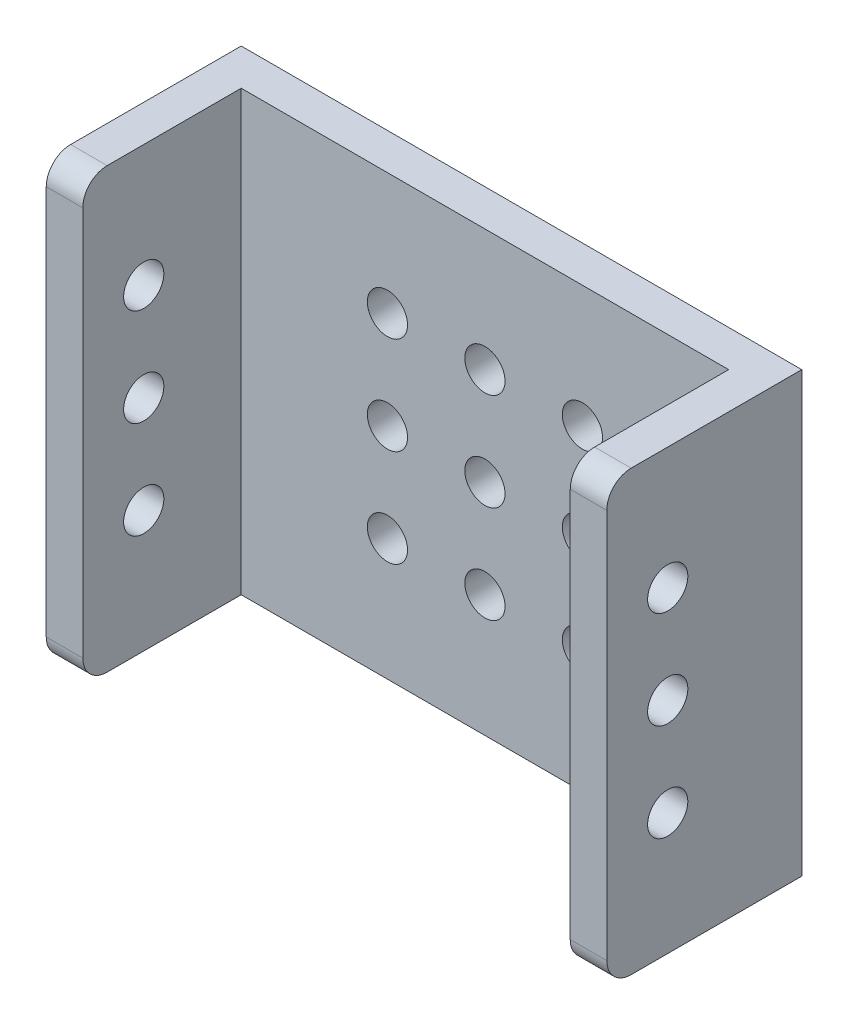
from build123d import *

# Parameters (mm, degrees)
SKETCH_2_W          = 46
SKETCH_2_H          = 36
SKETCH_2_R          = 1.65
EXTRUDE_1_DEPTH     = 3
SKETCH_3_W          = 3
SKETCH_3_H          = 36
EXTRUDE_2_DEPTH     = 13
CUT_EXTRUDE_1_DEPTH = 50
FILLET_1_R          = 2


with BuildPart() as part:
    # 草图2 → 凸台-拉伸1 (new body)
    with BuildSketch(Plane.XY):
        with Locations((23, 18)):
            Rectangle(SKETCH_2_W, SKETCH_2_H)
        with Locations((23, 18)):
            Circle(SKETCH_2_R, mode=Mode.SUBTRACT)
        with Locations((31, 18)):
            Circle(SKETCH_2_R, mode=Mode.SUBTRACT)
        with Locations((23, 26)):
            Circle(SKETCH_2_R, mode=Mode.SUBTRACT)
        with Locations((31, 26)):
            Circle(SKETCH_2_R, mode=Mode.SUBTRACT)
        with Locations((15, 26)):
            Circle(SKETCH_2_R, mode=Mode.SUBTRACT)
        with Locations((31, 10)):
            Circle(SKETCH_2_R, mode=Mode.SUBTRACT)
        with Locations((15, 18)):
            Circle(SKETCH_2_R, mode=Mode.SUBTRACT)
        with Locations((23, 10)):
            Circle(SKETCH_2_R, mode=Mode.SUBTRACT)
        with Locations((15, 10)):
            Circle(SKETCH_2_R, mode=Mode.SUBTRACT)
    extrude(amount=EXTRUDE_1_DEPTH)

    # 草图3 → 凸台-拉伸2 (add)
    with BuildSketch(Plane.XY.offset(3)):
        with Locations((1.5, 18)):
            Rectangle(SKETCH_3_W, SKETCH_3_H)
        with Locations((44.5, 18)):
            Rectangle(SKETCH_3_W, SKETCH_3_H)
    extrude(amount=EXTRUDE_2_DEPTH)

    # 草图4 → 切除-拉伸1 (cut)
    with BuildSketch(Plane(origin=(0, 0, 0), x_dir=(0, 0, -1), z_dir=(1, 0, 0))):
        with BuildLine():
            ThreePointArc((-9.35, 26), (-9.833273811, 27.166726189), (-11, 27.65))
            Line((-11, 27.65), (-11, 24.35))
            ThreePointArc((-11, 24.35), (-9.833273811, 24.833273811), (-9.35, 26))
        make_face()
        with BuildLine():
            Line((-11, 24.35), (-11, 27.65))
            ThreePointArc((-11, 27.65), (-12.65, 26), (-11, 24.35))
        make_face()
        with BuildLine():
            ThreePointArc((-11, 19.65), (-12.65, 18), (-11, 16.35))
            Line((-11, 16.35), (-11, 19.65))
        make_face()
        with BuildLine():
            Line((-11, 19.65), (-11, 16.35))
            ThreePointArc((-11, 16.35), (-9.833273811, 16.833273811), (-9.35, 18))
            ThreePointArc((-9.35, 18), (-9.833273811, 19.166726189), (-11, 19.65))
        make_face()
        with BuildLine():
            ThreePointArc((-11, 11.65), (-12.65, 10), (-11, 8.35))
            Line((-11, 8.35), (-11, 11.65))
        make_face()
        with BuildLine():
            Line((-11, 11.65), (-11, 8.35))
            ThreePointArc((-11, 8.35), (-9.833273811, 8.833273811), (-9.35, 10))
            ThreePointArc((-9.35, 10), (-9.833273811, 11.166726189), (-11, 11.65))
        make_face()
    extrude(amount=CUT_EXTRUDE_1_DEPTH, mode=Mode.SUBTRACT)

    # 圆角1
    fillet_1_edges = [part.edges().sort_by_distance(p)[0] for p in [
        (1.5, 36, 16),
        (1.5, 0, 16),
        (44.5, 0, 16),
        (44.5, 36, 16),
    ]]
    fillet(fillet_1_edges, radius=FILLET_1_R)


solid = part.part
